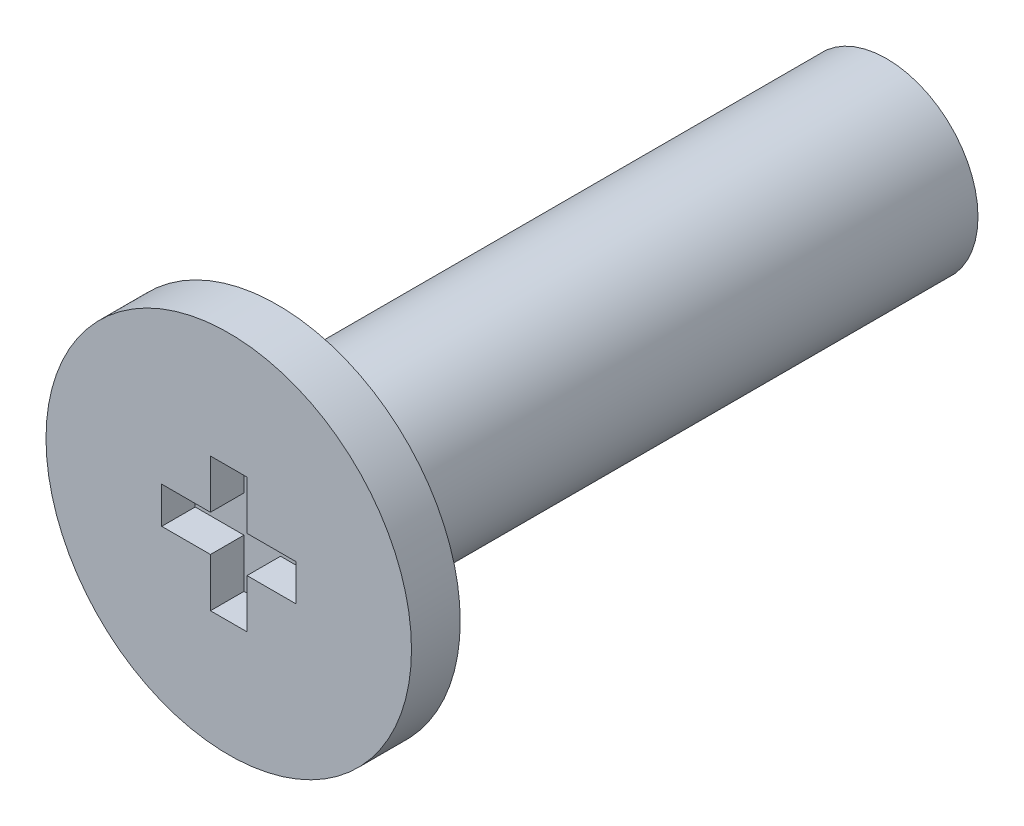
from build123d import *

# Parameters (mm, degrees)
SKETCH_1_R        = 1.5
EXTRUDE_198_DEPTH = 10
SKETCH_6_W        = 3
SKETCH_6_H        = 0.8
PH1_START         = 0.81
PH1_DEPTH         = 0.56


with BuildPart() as part:
    # 草图1 → Extrude 198 (new body)
    with BuildSketch(Plane.XY):
        Circle(SKETCH_1_R)
    extrude(amount=-EXTRUDE_198_DEPTH)

    # 草图6 → Revolve 324 (revolve)
    with BuildSketch(Plane(origin=(0, 0, 0), x_dir=(1, 0, 0), z_dir=(0, 1, 0)), mode=Mode.PRIVATE) as revolve_324_sk:
        with Locations((1.5, -0.4)):
            Rectangle(SKETCH_6_W, SKETCH_6_H)
    revolve(revolve_324_sk.sketch.rotate(Axis((0, 0, -2), (0, 0, 1)), 180), axis=Axis((0, 0, -2), (0, 0, 1)))

    # 草图7 → 十字槽_PH1_简化 (cut)
    with BuildSketch(Plane.XY.offset(PH1_START)):
        Polygon((-0.3, -1.1), (0.3, -1.1), (0.3, -0.3), (1.1, -0.3), (1.1, 0.3), (0.3, 0.3), (0.3, 1.1), (-0.3, 1.1), (-0.3, 0.3), (-1.1, 0.3), (-1.1, -0.3), (-0.3, -0.3), align=None)
    extrude(amount=-PH1_DEPTH, mode=Mode.SUBTRACT)


solid = part.part
